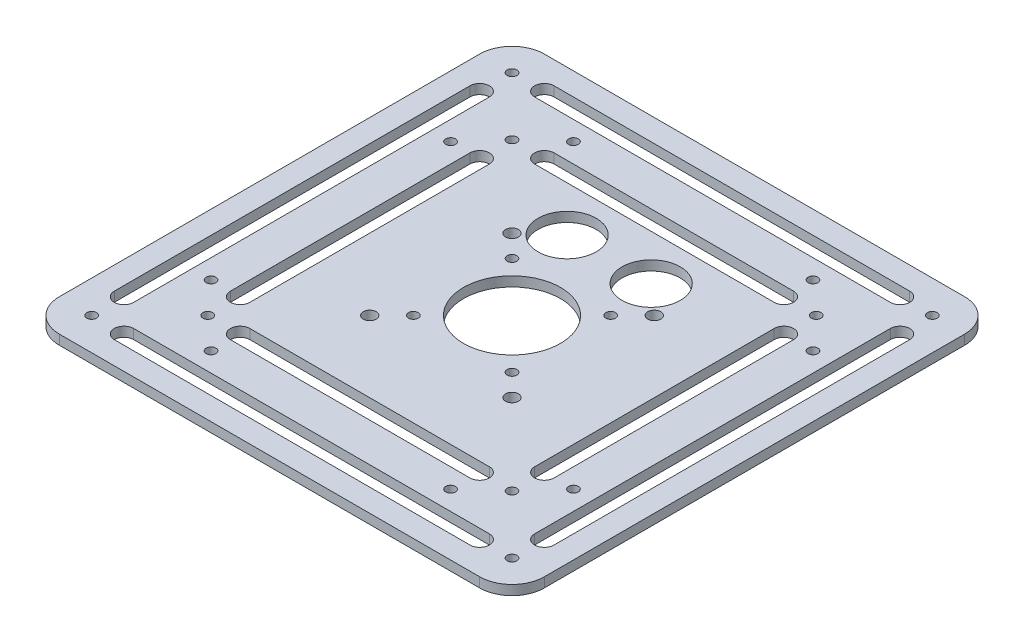
from build123d import *

# Parameters (mm, degrees)
SKETCH1_R           = 1.5
SKETCH1_R_2         = 15
SKETCH1_R_3         = 9
SKETCH1_R_4         = 2
BOSS_EXTRUDE1_DEPTH = 3


with BuildPart() as part:
    # Sketch1 → Boss-Extrude1 (new body)
    with BuildSketch(Plane(origin=(0, 0, 0), x_dir=(1, 0, 0), z_dir=(0, 1, 0))):
        with BuildLine():
            Line((-65, -75), (65, -75))
            ThreePointArc((65, -75), (72.071067812, -72.071067812), (75, -65))
            Line((75, -65), (75, 65))
            ThreePointArc((75, 65), (72.071067812, 72.071067812), (65, 75))
            Line((65, 75), (-65, 75))
            ThreePointArc((-65, 75), (-72.071067812, 72.071067812), (-75, 65))
            Line((-75, 65), (-75, -65))
            ThreePointArc((-75, -65), (-72.071067812, -72.071067812), (-65, -75))
        make_face()
        with Locations(Location((65, 65, 0), (0, 0, 270))):
            Circle(SKETCH1_R, mode=Mode.SUBTRACT)
        with Locations(Location((47.039487758, 47.039487758, 0), (0, 0, 270))):
            Circle(SKETCH1_R, mode=Mode.SUBTRACT)
        with Locations(Location((-65, 65, 0), (0, 0, 90))):
            Circle(SKETCH1_R, mode=Mode.SUBTRACT)
        with Locations(Location((-47.039487758, 47.039487758, 0), (0, 0, 90))):
            Circle(SKETCH1_R, mode=Mode.SUBTRACT)
        with Locations(Location((65, -65, 0), (0, 0, 90))):
            Circle(SKETCH1_R, mode=Mode.SUBTRACT)
        with Locations(Location((47.039487758, -47.039487758, 0), (0, 0, 90))):
            Circle(SKETCH1_R, mode=Mode.SUBTRACT)
        with Locations(Location((-65, -65, 0), (0, 0, 270))):
            Circle(SKETCH1_R, mode=Mode.SUBTRACT)
        with Locations(Location((-47.039487758, -47.039487758, 0), (0, 0, 270))):
            Circle(SKETCH1_R, mode=Mode.SUBTRACT)
        with Locations(Location((0, 0, 0), (0, 0, 270))):
            Circle(SKETCH1_R_2, mode=Mode.SUBTRACT)
        with Locations(Location((-56.039487758, 37.039487758, 0), (0, 0, 270))):
            Circle(SKETCH1_R, mode=Mode.SUBTRACT)
        with Locations(Location((-56.039487758, -37.039487758, 0), (0, 0, 90))):
            Circle(SKETCH1_R, mode=Mode.SUBTRACT)
        with Locations(Location((56.039487758, -37.039487758, 0), (0, 0, 270))):
            Circle(SKETCH1_R, mode=Mode.SUBTRACT)
        with Locations(Location((56.039487758, 37.039487758, 0), (0, 0, 90))):
            Circle(SKETCH1_R, mode=Mode.SUBTRACT)
        with Locations(Location((-37.039487758, 56.039487758, 0), (0, 0, 90))):
            Circle(SKETCH1_R, mode=Mode.SUBTRACT)
        with Locations(Location((37.039487758, 56.039487758, 0), (0, 0, 270))):
            Circle(SKETCH1_R, mode=Mode.SUBTRACT)
        with Locations(Location((-37.039487758, -56.039487758, 0), (0, 0, 270))):
            Circle(SKETCH1_R, mode=Mode.SUBTRACT)
        with Locations(Location((37.039487758, -56.039487758, 0), (0, 0, 90))):
            Circle(SKETCH1_R, mode=Mode.SUBTRACT)
        with Locations(Location((-15.25, 15.25, 0), (0, 0, 270))):
            Circle(SKETCH1_R, mode=Mode.SUBTRACT)
        with Locations(Location((15.25, 15.25, 0), (0, 0, 90))):
            Circle(SKETCH1_R, mode=Mode.SUBTRACT)
        with Locations(Location((-15.25, -15.25, 0), (0, 0, 90))):
            Circle(SKETCH1_R, mode=Mode.SUBTRACT)
        with Locations(Location((15.25, -15.25, 0), (0, 0, 90))):
            Circle(SKETCH1_R, mode=Mode.SUBTRACT)
        with Locations(Location((-13, 30.039487758, 0), (0, 0, 270))):
            Circle(SKETCH1_R_3, mode=Mode.SUBTRACT)
        with Locations(Location((13, 30.039487758, 0), (0, 0, 90))):
            Circle(SKETCH1_R_3, mode=Mode.SUBTRACT)
        with Locations(Location((-22, 22, 0), (0, 0, 270))):
            Circle(SKETCH1_R_4, mode=Mode.SUBTRACT)
        with Locations(Location((22, 22, 0), (0, 0, 90))):
            Circle(SKETCH1_R_4, mode=Mode.SUBTRACT)
        with Locations(Location((22, -22, 0), (0, 0, 90))):
            Circle(SKETCH1_R_4, mode=Mode.SUBTRACT)
        with Locations(Location((-22, -22, 0), (0, 0, 90))):
            Circle(SKETCH1_R_4, mode=Mode.SUBTRACT)
        with BuildLine():
            Line((-44.039487758, 37.039487758), (-44.039487758, -37.039487758))
            ThreePointArc((-44.039487758, -37.039487758), (-47.039487758, -40.039487758), (-50.039487758, -37.039487758))
            Line((-50.039487758, -37.039487758), (-50.039487758, 37.039487758))
            ThreePointArc((-50.039487758, 37.039487758), (-47.039487758, 40.039487758), (-44.039487758, 37.039487758))
        make_face(mode=Mode.SUBTRACT)
        with BuildLine():
            Line((44.039487758, 37.039487758), (44.039487758, -37.039487758))
            ThreePointArc((44.039487758, -37.039487758), (47.039487758, -40.039487758), (50.039487758, -37.039487758))
            Line((50.039487758, -37.039487758), (50.039487758, 37.039487758))
            ThreePointArc((50.039487758, 37.039487758), (47.039487758, 40.039487758), (44.039487758, 37.039487758))
        make_face(mode=Mode.SUBTRACT)
        with BuildLine():
            Line((-37.039487758, 44.039487758), (37.039487758, 44.039487758))
            ThreePointArc((37.039487758, 44.039487758), (40.039487758, 47.039487758), (37.039487758, 50.039487758))
            Line((37.039487758, 50.039487758), (-37.039487758, 50.039487758))
            ThreePointArc((-37.039487758, 50.039487758), (-40.039487758, 47.039487758), (-37.039487758, 44.039487758))
        make_face(mode=Mode.SUBTRACT)
        with BuildLine():
            Line((37.039487758, -44.039487758), (-37.039487758, -44.039487758))
            ThreePointArc((-37.039487758, -44.039487758), (-40.039487758, -47.039487758), (-37.039487758, -50.039487758))
            Line((-37.039487758, -50.039487758), (37.039487758, -50.039487758))
            ThreePointArc((37.039487758, -50.039487758), (40.039487758, -47.039487758), (37.039487758, -44.039487758))
        make_face(mode=Mode.SUBTRACT)
        with BuildLine():
            Line((-62, 55), (-62, -55))
            ThreePointArc((-62, -55), (-65, -58), (-68, -55))
            Line((-68, -55), (-68, 55))
            ThreePointArc((-68, 55), (-65, 58), (-62, 55))
        make_face(mode=Mode.SUBTRACT)
        with BuildLine():
            Line((62, 55), (62, -55))
            ThreePointArc((62, -55), (65, -58), (68, -55))
            Line((68, -55), (68, 55))
            ThreePointArc((68, 55), (65, 58), (62, 55))
        make_face(mode=Mode.SUBTRACT)
        with BuildLine():
            Line((-55, 62), (55, 62))
            ThreePointArc((55, 62), (58, 65), (55, 68))
            Line((55, 68), (-55, 68))
            ThreePointArc((-55, 68), (-58, 65), (-55, 62))
        make_face(mode=Mode.SUBTRACT)
        with BuildLine():
            Line((55, -62), (-55, -62))
            ThreePointArc((-55, -62), (-58, -65), (-55, -68))
            Line((-55, -68), (55, -68))
            ThreePointArc((55, -68), (58, -65), (55, -62))
        make_face(mode=Mode.SUBTRACT)
    extrude(amount=BOSS_EXTRUDE1_DEPTH)


solid = part.part
